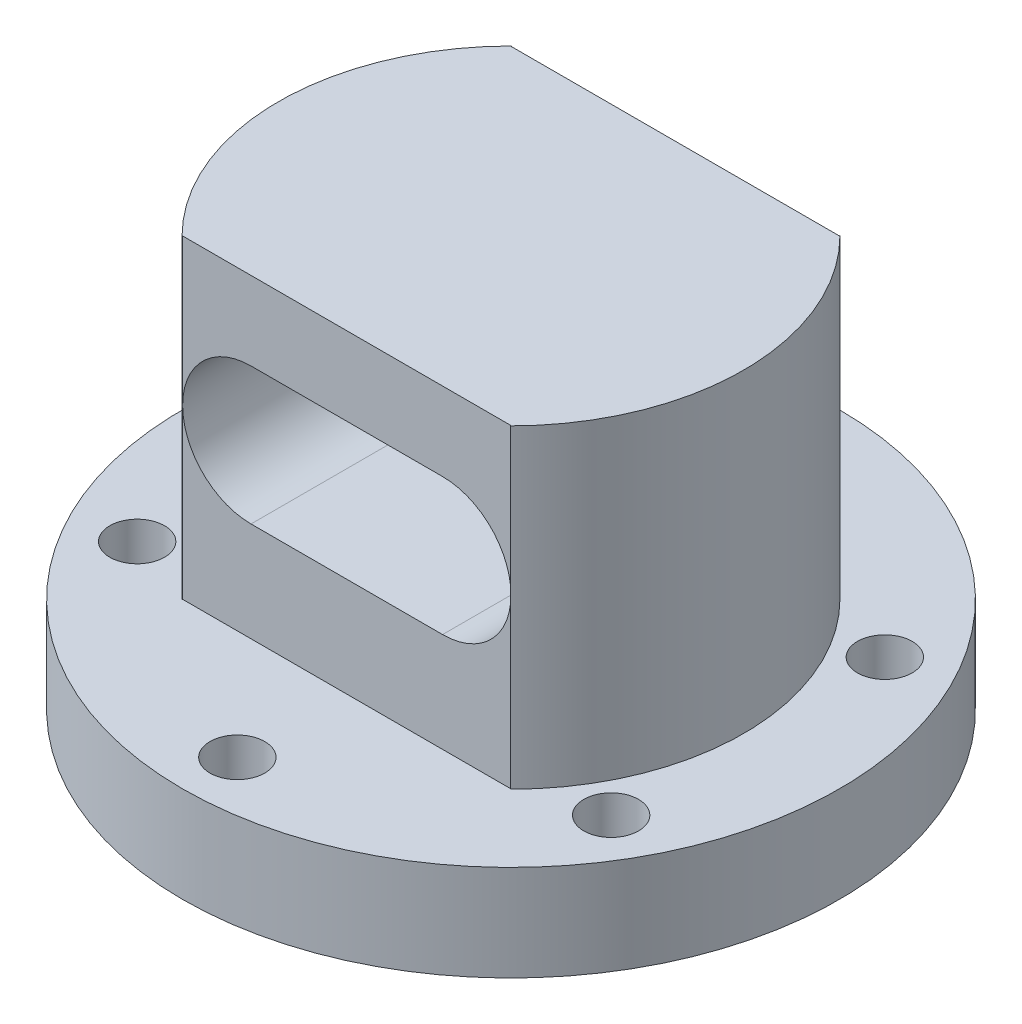
from build123d import *

# Parameters (mm, degrees)
SKETCH_1_R          = 24
EXTRUDE_1_DEPTH     = 7
SKETCH_2_R          = 17
EXTRUDE_2_DEPTH     = 23
CUT_EXTRUDE_1_DEPTH = 23
CUT_EXTRUDE_3_REACH = 47.299
SKETCH_4_W          = 24
SKETCH_4_H          = 8.031532799
SKETCH_5_R          = 2
CUT_EXTRUDE_2_DEPTH = 42


with BuildPart() as part:
    # Эскиз1 → Вытянуть1 (new body)
    with BuildSketch(Plane(origin=(0, 0, 0), x_dir=(1, 0, 0), z_dir=(0, 1, 0))):
        with Locations(Location((0, 0, 0), (0, 0, 270))):
            Circle(SKETCH_1_R)
    extrude(amount=EXTRUDE_1_DEPTH)

    # Эскиз2 → Вытянуть2 (add)
    with BuildSketch(Plane(origin=(0, 7, 0), x_dir=(1, 0, 0), z_dir=(0, 1, 0))):
        with Locations(Location((0, 0, 0), (0, 0, 270))):
            Circle(SKETCH_2_R)
    extrude(amount=EXTRUDE_2_DEPTH)

    # Эскиз3 → Вырез-Вытянуть1 (cut, symmetric)
    with BuildSketch(Plane.XY):
        with BuildLine():
            Line((-7, 24.269678179), (7, 24.269678179))
            ThreePointArc((7, 24.269678179), (12, 19.269678179), (7, 14.269678179))
            Line((7, 14.269678179), (-7, 14.269678179))
            ThreePointArc((-7, 14.269678179), (-12, 19.269678179), (-7, 24.269678179))
        make_face()
    extrude(amount=CUT_EXTRUDE_1_DEPTH, both=True, mode=Mode.SUBTRACT)

    # Вытянуть3: up to this face of the body (flat: up to its plane)
    cut_extrude_3_end = Plane(part.part.faces().sort_by_distance((0, 7, -23.32117749))[0])
    # Эскиз4 → Вытянуть3 (cut, up to the picked face)
    with BuildSketch(Plane(origin=(0, 30, 0), x_dir=(-1, 0, 0), z_dir=(0, 1, 0)), mode=Mode.PRIVATE) as cut_extrude_3_sk1:
        with Locations((0, -16.0157664)):
            Rectangle(SKETCH_4_W, SKETCH_4_H)
    cut_extrude_3_tool1 = split(extrude(cut_extrude_3_sk1.sketch, amount=-CUT_EXTRUDE_3_REACH, mode=Mode.PRIVATE), bisect_by=cut_extrude_3_end, keep=Keep.BOTH, mode=Mode.PRIVATE)
    # Эскиз4 → Вытянуть3 (cut, up to the picked face)
    with BuildSketch(Plane(origin=(0, 30, 0), x_dir=(-1, 0, 0), z_dir=(0, 1, 0)), mode=Mode.PRIVATE) as cut_extrude_3_sk2:
        with Locations((0, 16.0157664)):
            Rectangle(SKETCH_4_W, SKETCH_4_H)
    cut_extrude_3_tool2 = split(extrude(cut_extrude_3_sk2.sketch, amount=-CUT_EXTRUDE_3_REACH, mode=Mode.PRIVATE), bisect_by=cut_extrude_3_end, keep=Keep.BOTH, mode=Mode.PRIVATE)
    add(cut_extrude_3_tool1.solids().sort_by(Axis((0, 30, -16.015766), (0, -1, 0)))[0], mode=Mode.SUBTRACT)
    add(cut_extrude_3_tool2.solids().sort_by(Axis((0, 30, 16.015766), (0, -1, 0)))[0], mode=Mode.SUBTRACT)

    # Эскиз5 → Вырез-Вытянуть2 (cut, through all)
    with BuildSketch(Plane(origin=(0, 7, 0), x_dir=(1, 0, 0), z_dir=(0, 1, 0))):
        with Locations(Location((0, 20, 0), (0, 0, 270))):
            Circle(SKETCH_5_R)
        with Locations(Location((17.320508076, 10, 0), (0, 0, 270))):
            Circle(SKETCH_5_R)
        with Locations(Location((17.320508076, -10, 0), (0, 0, 270))):
            Circle(SKETCH_5_R)
        with Locations(Location((0, -20, 0), (0, 0, 270))):
            Circle(SKETCH_5_R)
        with Locations(Location((-17.320508076, -10, 0), (0, 0, 270))):
            Circle(SKETCH_5_R)
        with Locations(Location((-17.320508076, 10, 0), (0, 0, 270))):
            Circle(SKETCH_5_R)
    extrude(amount=-CUT_EXTRUDE_2_DEPTH, mode=Mode.SUBTRACT)


solid = part.part
